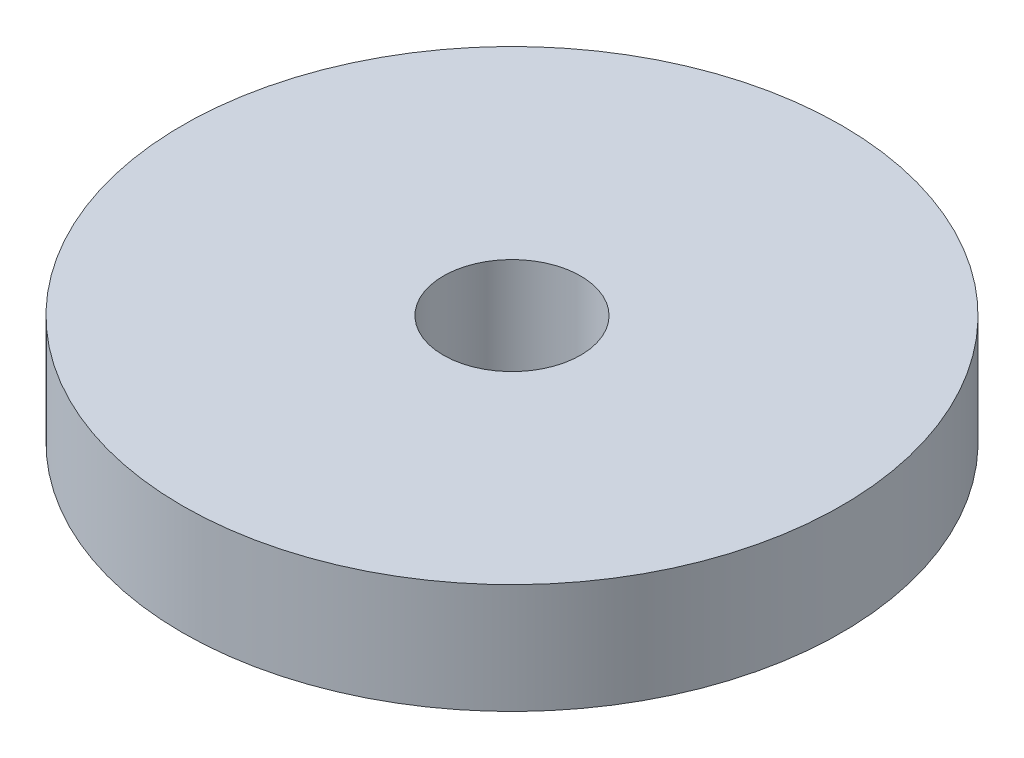
from build123d import *

# Parameters (mm, degrees)
SKETCH1_R           = 15.24
SKETCH1_R_2         = 3.175
BOSS_EXTRUDE1_DEPTH = 5.08


with BuildPart() as part:
    # Sketch1 → Boss-Extrude1 (new body)
    with BuildSketch(Plane(origin=(0, 0, 0), x_dir=(1, 0, 0), z_dir=(0, 1, 0))):
        with Locations(Location((0, 0, 0), (0, 0, 270))):
            Circle(SKETCH1_R)
        with Locations(Location((0, 0, 0), (0, 0, 270))):
            Circle(SKETCH1_R_2, mode=Mode.SUBTRACT)
    extrude(amount=BOSS_EXTRUDE1_DEPTH)


solid = part.part
